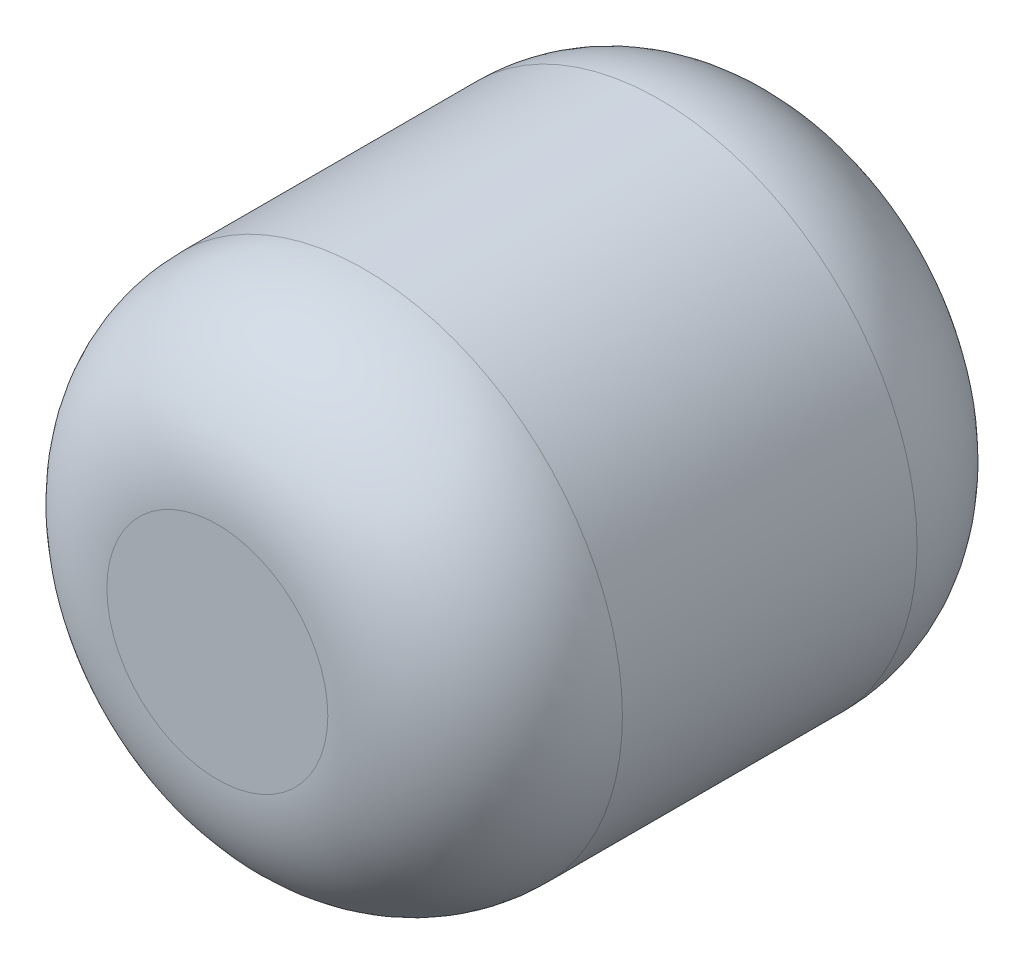
from build123d import *

# Parameters (mm, degrees)
ESQUISSE1_R        = 44.45
BOSS_EXTRU_1_DEPTH = 101.6
CONG_1_R           = 25.4


with BuildPart() as part:
    # Esquisse1 → Boss.-Extru.1 (new body)
    with BuildSketch(Plane.XY):
        Circle(ESQUISSE1_R)
    extrude(amount=BOSS_EXTRU_1_DEPTH)

    # Congé1
    cong_1_edges = [part.edges().sort_by_distance(p)[0] for p in [
        (-44.45, 0, 0),
        (-44.45, 0, 101.6),
    ]]
    fillet(cong_1_edges, radius=CONG_1_R)


solid = part.part
